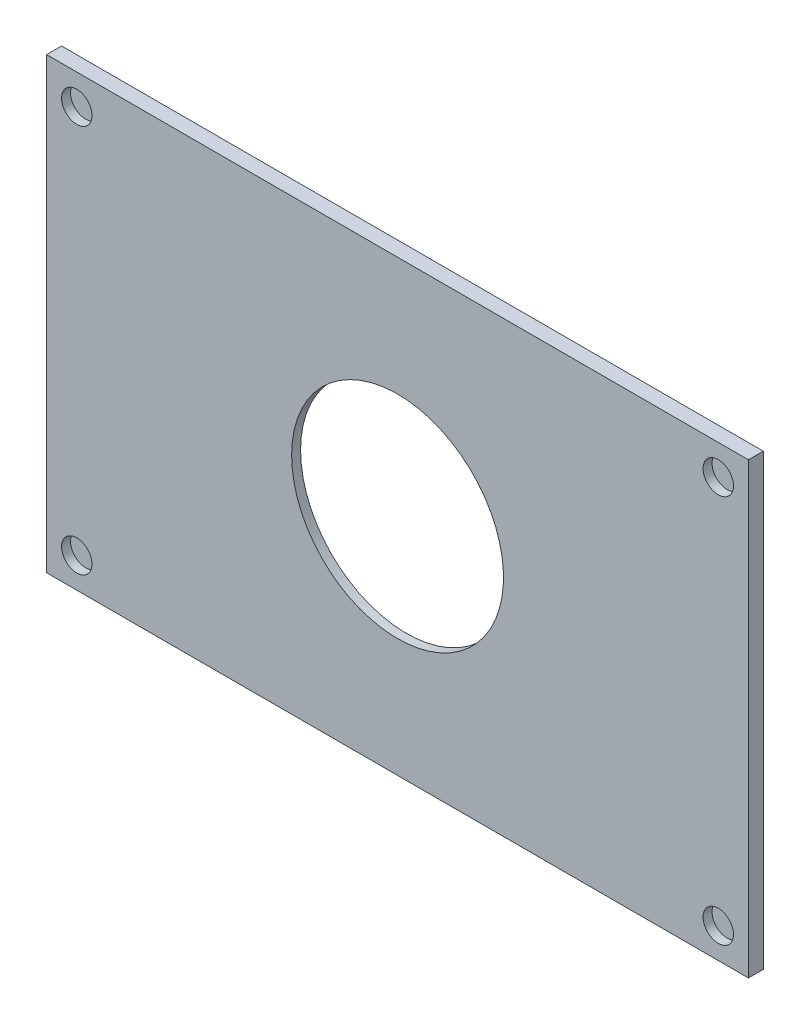
from build123d import *

# Parameters (mm, degrees)
SKETCH1_W           = 298.704
SKETCH1_H           = 191.008
SKETCH1_R           = 6.477
SKETCH1_R_2         = 45.085
BOSS_EXTRUDE1_DEPTH = 3.81
SKETCH3_W           = 298.704
SKETCH3_H           = 191.008
SKETCH3_R           = 47.625
BOSS_EXTRUDE2_DEPTH = 2.54
CUT_EXTRUDE1_START  = -3.81
SKETCH4_R           = 50.165
CUT_EXTRUDE1_DEPTH  = 2.54


with BuildPart() as part:
    # Sketch1 → Boss-Extrude1 (new body)
    with BuildSketch(Plane.XY):
        with Locations((149.352, -95.504)):
            Rectangle(SKETCH1_W, SKETCH1_H)
        with Locations(Location((12.827, -12.827, 0), (0, 0, 180))):
            Circle(SKETCH1_R, mode=Mode.SUBTRACT)
        with Locations(Location((285.877, -12.827, 0), (0, 0, 180))):
            Circle(SKETCH1_R, mode=Mode.SUBTRACT)
        with Locations(Location((285.877, -178.181, 0), (0, 0, 180))):
            Circle(SKETCH1_R, mode=Mode.SUBTRACT)
        with Locations(Location((12.827, -178.181, 0), (0, 0, 180))):
            Circle(SKETCH1_R, mode=Mode.SUBTRACT)
        with Locations(Location((149.352, -95.504, 0), (0, 0, 180))):
            Circle(SKETCH1_R_2, mode=Mode.SUBTRACT)
    extrude(amount=BOSS_EXTRUDE1_DEPTH)

    # Sketch3 → Boss-Extrude2 (add)
    with BuildSketch(Plane(origin=(0, 0, 0), x_dir=(-1, 0, 0), z_dir=(0, 0, -1))):
        with Locations((-149.352, -95.504)):
            Rectangle(SKETCH3_W, SKETCH3_H)
        with Locations((-149.352, -95.504)):
            Circle(SKETCH3_R, mode=Mode.SUBTRACT)
    extrude(amount=BOSS_EXTRUDE2_DEPTH)

    # Sketch4 → Cut-Extrude1 (cut)
    with BuildSketch(Plane.XY.offset(3.81).offset(CUT_EXTRUDE1_START)):
        with Locations((149.352, -95.504)):
            Circle(SKETCH4_R)
    extrude(amount=-CUT_EXTRUDE1_DEPTH, mode=Mode.SUBTRACT)


solid = part.part
